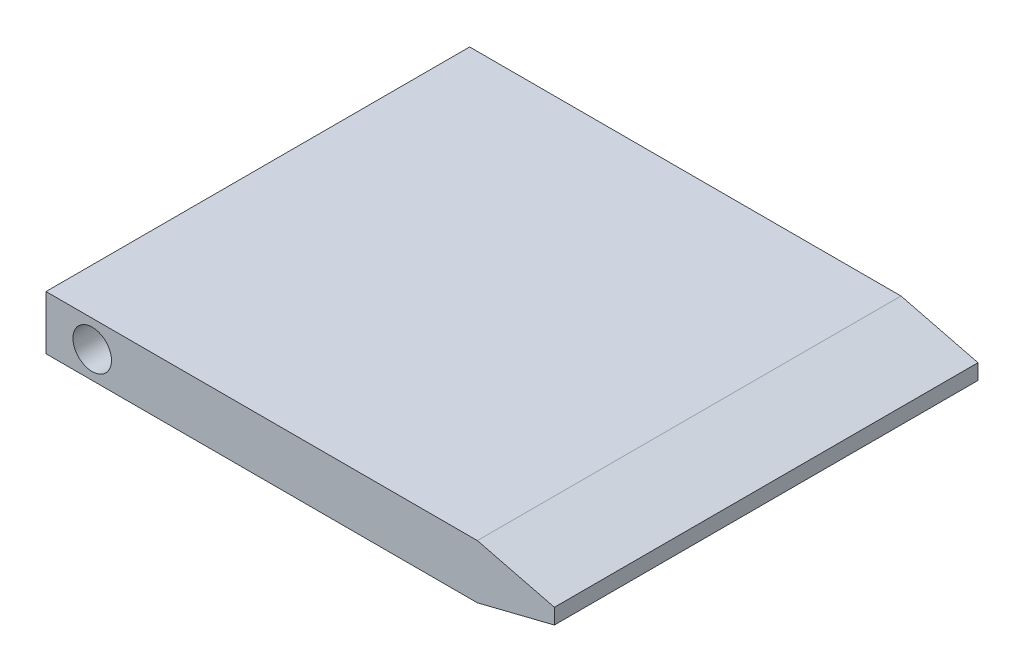
from build123d import *
from OCP.BRepFilletAPI import BRepFilletAPI_MakeChamfer

# Parameters (mm, degrees)
SKETCH1_W           = 44
SKETCH1_H           = 55
BOSS_EXTRUDE1_DEPTH = 7
CUT_EXTRUDE1_DEPTH  = 100
SKETCH3_W           = 55
SKETCH3_H           = 7
BOSS_EXTRUDE2_DEPTH = 22
CHAMFER1_SIZE       = 10
CHAMFER1_SIZE2      = 2.5


with BuildPart() as part:
    # Sketch1 → Boss-Extrude1 (new body)
    with BuildSketch(Plane(origin=(0, 0, 0), x_dir=(1, 0, 0), z_dir=(0, 1, 0))):
        with Locations((-1.59375, 18.75)):
            Rectangle(SKETCH1_W, SKETCH1_H)
    extrude(amount=BOSS_EXTRUDE1_DEPTH)

    # Sketch2 → Cut-Extrude1 (cut)
    with BuildSketch(Plane.XY.offset(8.75)):
        with BuildLine():
            ThreePointArc((-15.09375, 3.5), (-15.825983047, 5.267766953), (-17.59375, 6))
            Line((-17.59375, 6), (-17.59375, 1))
            ThreePointArc((-17.59375, 1), (-15.825983047, 1.732233047), (-15.09375, 3.5))
        make_face()
        with BuildLine():
            Line((-17.59375, 1), (-17.59375, 6))
            ThreePointArc((-17.59375, 6), (-20.09375, 3.5), (-17.59375, 1))
        make_face()
    extrude(amount=-CUT_EXTRUDE1_DEPTH, mode=Mode.SUBTRACT)

    # Sketch3 → Boss-Extrude2 (add)
    with BuildSketch(Plane(origin=(20.40625, 0, 0), x_dir=(0, 0, -1), z_dir=(1, 0, 0))):
        with Locations((18.75, 3.5)):
            Rectangle(SKETCH3_W, SKETCH3_H)
    extrude(amount=BOSS_EXTRUDE2_DEPTH)

    # Chamfer1: one chamfer whose edges measure the first distance from different faces: ONE call of the kernel's chamfer builder (chamfer() names one face for all edges)
    chamfer1_edges_1 = [part.edges().sort_by_distance(p)[0] for p in [
        (42.40625, 0, -18.75),
    ]]
    chamfer1_side_1 = [part.faces().sort_by_distance(p)[0] for p in [
        (9.40625, 0, -18.75),
    ]]
    chamfer1_edges_2 = [part.edges().sort_by_distance(p)[0] for p in [
        (42.40625, 7, -18.75),
    ]]
    chamfer1_side_2 = [part.faces().sort_by_distance(p)[0] for p in [
        (9.40625, 7, -18.75),
    ]]
    chamfer1 = BRepFilletAPI_MakeChamfer(part.part.solid().wrapped)
    for e in chamfer1_edges_1:
        chamfer1.Add(CHAMFER1_SIZE, CHAMFER1_SIZE2, e.wrapped, chamfer1_side_1[0].wrapped)  # the first distance lies on this face
    for e in chamfer1_edges_2:
        chamfer1.Add(CHAMFER1_SIZE, CHAMFER1_SIZE2, e.wrapped, chamfer1_side_2[0].wrapped)  # the first distance lies on this face
    add(Compound.cast(chamfer1.Shape()), mode=Mode.REPLACE)


solid = part.part
